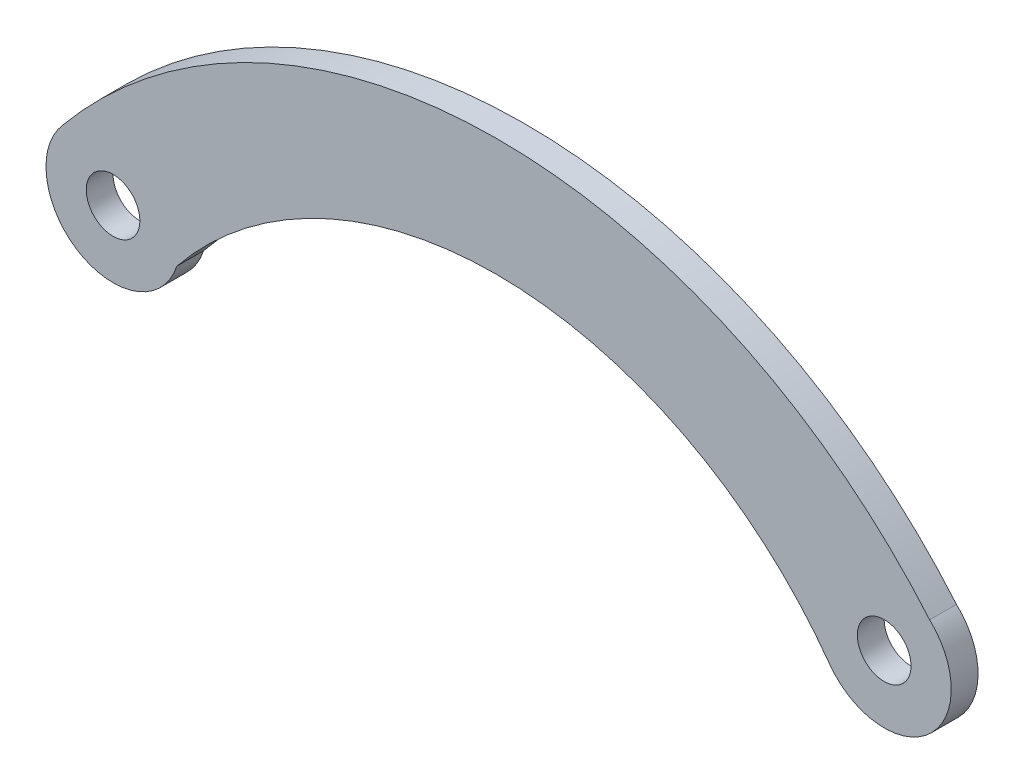
from build123d import *

# Parameters (mm, degrees)
SKETCH1_R           = 2
BOSS_EXTRUDE1_DEPTH = 2


with BuildPart() as part:
    # Sketch1 → Boss-Extrude1 (new body)
    with BuildSketch(Plane.XY):
        with BuildLine():
            ThreePointArc((53.438519997, -2.916227046), (29.432656621, 9.827154462), (4.752138317, -1.554728727))
            ThreePointArc((4.752138317, -1.554728727), (-2.486820582, -4.337709464), (-3.742737075, 3.315406338))
            ThreePointArc((-3.742737075, 3.315406338), (28.489729082, 18.618480506), (60.890433455, 3.674909657))
            ThreePointArc((60.890433455, 3.674909657), (60.812604206, -3.7452174), (53.438519997, -2.916227046))
        make_face()
        Circle(SKETCH1_R, mode=Mode.SUBTRACT)
        with Locations((57.5, 0)):
            Circle(SKETCH1_R, mode=Mode.SUBTRACT)
    extrude(amount=BOSS_EXTRUDE1_DEPTH)


solid = part.part
